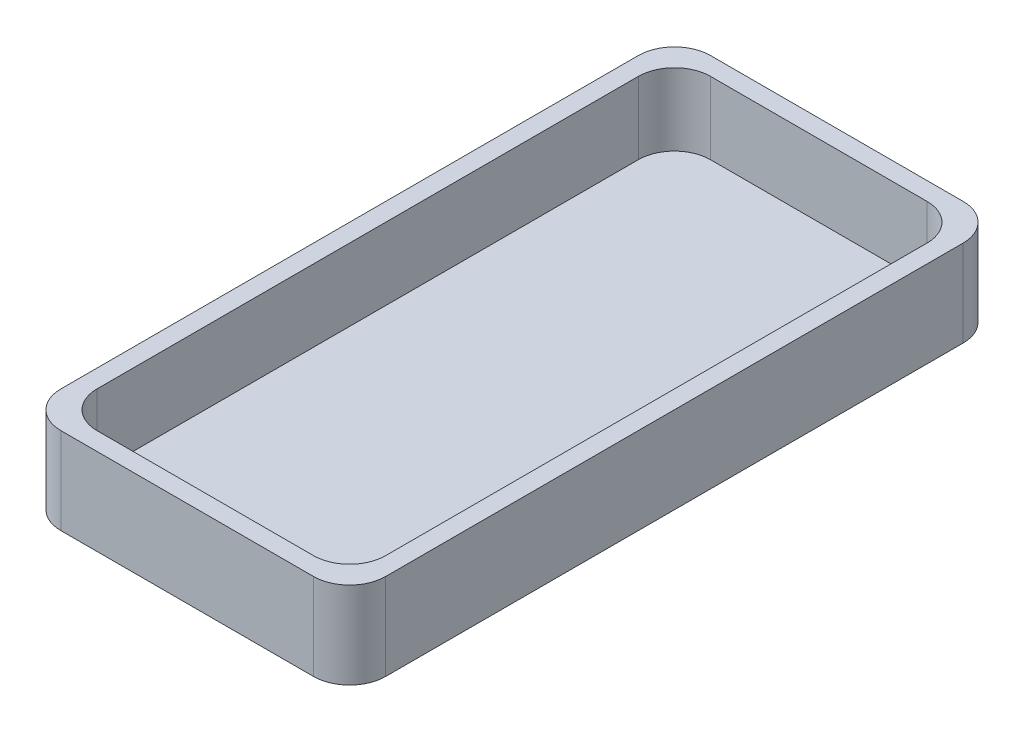
from build123d import *

# Parameters (mm, degrees)
BOSS_EXTRUDE1_DEPTH = 24
CUT_EXTRUDE1_DEPTH  = 20


with BuildPart() as part:
    # Sketch3 → Boss-Extrude1 (new body)
    with BuildSketch(Plane(origin=(0, 0, 0), x_dir=(1, 0, 0), z_dir=(0, 1, 0))):
        with BuildLine():
            Line((-45, 80), (-45, -80))
            ThreePointArc((-45, -80), (-42.071067812, -87.071067812), (-35, -90))
            Line((-35, -90), (35, -90))
            ThreePointArc((35, -90), (42.071067812, -87.071067812), (45, -80))
            Line((45, -80), (45, 80))
            ThreePointArc((45, 80), (42.071067812, 87.071067812), (35, 90))
            Line((35, 90), (-35, 90))
            ThreePointArc((-35, 90), (-42.071067812, 87.071067812), (-45, 80))
        make_face()
    extrude(amount=BOSS_EXTRUDE1_DEPTH)

    # Sketch4 → Cut-Extrude1 (cut)
    with BuildSketch(Plane(origin=(0, 24, 0), x_dir=(1, 0, 0), z_dir=(0, 1, 0))):
        with BuildLine():
            Line((-40, 75), (-40, -75))
            ThreePointArc((-40, -75), (-37.071067812, -82.071067812), (-30, -85))
            Line((-30, -85), (30, -85))
            ThreePointArc((30, -85), (37.071067812, -82.071067812), (40, -75))
            Line((40, -75), (40, 75))
            ThreePointArc((40, 75), (37.071067812, 82.071067812), (30, 85))
            Line((30, 85), (-30, 85))
            ThreePointArc((-30, 85), (-37.071067812, 82.071067812), (-40, 75))
        make_face()
    extrude(amount=-CUT_EXTRUDE1_DEPTH, mode=Mode.SUBTRACT)


solid = part.part
